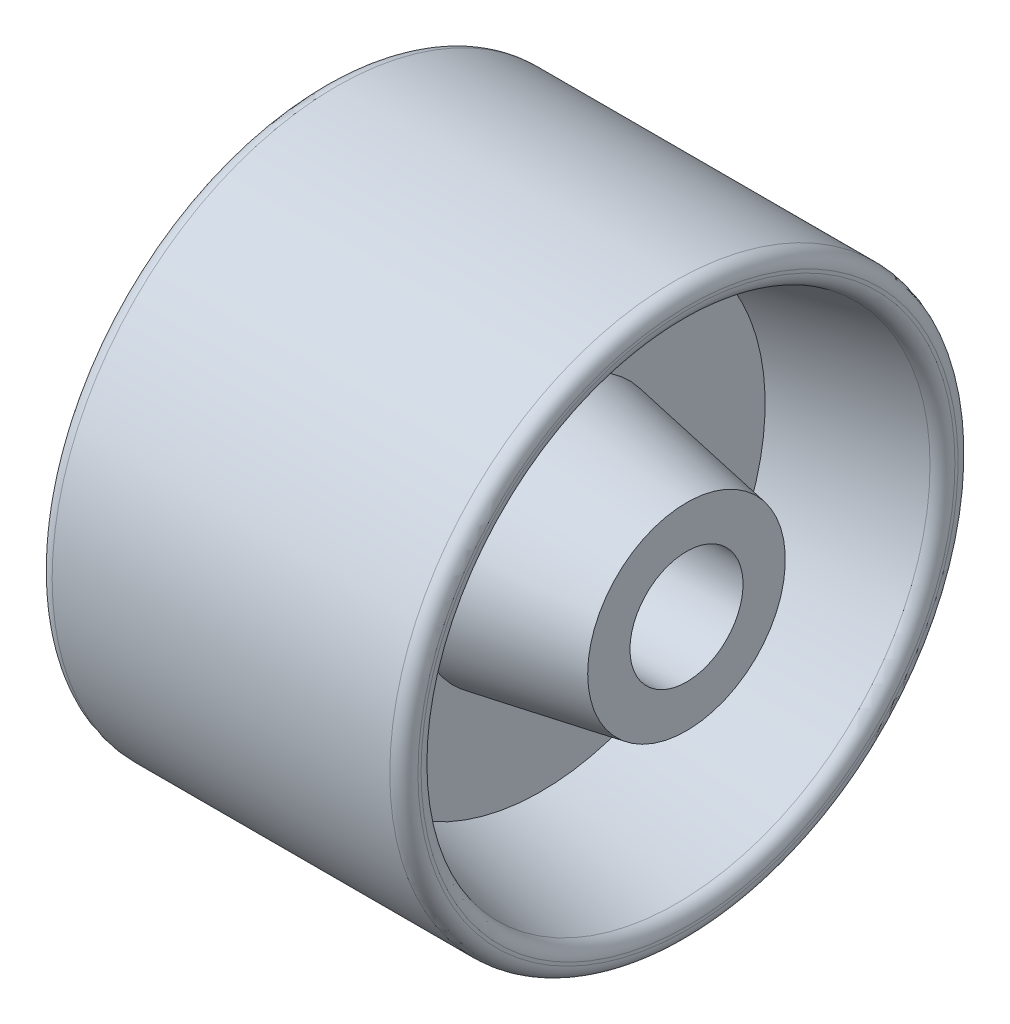
from build123d import *

# Parameters (mm, degrees)
FILLET1_R = 5
FILLET2_R = 5
FILLET3_R = 5


with BuildPart() as part:
    # Sketch1 → Revolve1 (revolve)
    with BuildSketch(Plane.XY, mode=Mode.PRIVATE) as revolve1_sk:
        Polygon((64.406730934, 20.074337298), (64.406730934, 35.087163878), (12.827354924, 44.181999517), (12.827354924, 79.50287687), (64.938484301, 90.726812428), (64.938484301, 100.877802998), (-64.938484301, 100.877802998), (-64.938484301, 90.726812428), (-12.827354924, 79.50287687), (-12.827354924, 44.181999517), (-64.406730934, 35.087163878), (-64.406730934, 20.074337298), align=None)
    revolve(revolve1_sk.sketch.rotate(Axis((-142.971560085, 0, 0), (1, 0, 0)), 90), axis=Axis((-142.971560085, 0, 0), (1, 0, 0)))

    # Fillet1
    fillet1_edges = [part.edges().sort_by_distance(p)[0] for p in [
        (-64.938484301, 0, -100.877802998),
    ]]
    fillet(fillet1_edges, radius=FILLET1_R)

    # Fillet2
    fillet2_edges = [part.edges().sort_by_distance(p)[0] for p in [
        (64.938484301, 0, -90.726812428),
        (64.938484301, 0, -100.877802998),
    ]]
    fillet(fillet2_edges, radius=FILLET2_R)

    # Fillet3
    fillet3_edges = [part.edges().sort_by_distance(p)[0] for p in [
        (-64.938484301, 0, -90.726812428),
    ]]
    fillet(fillet3_edges, radius=FILLET3_R)


solid = part.part
